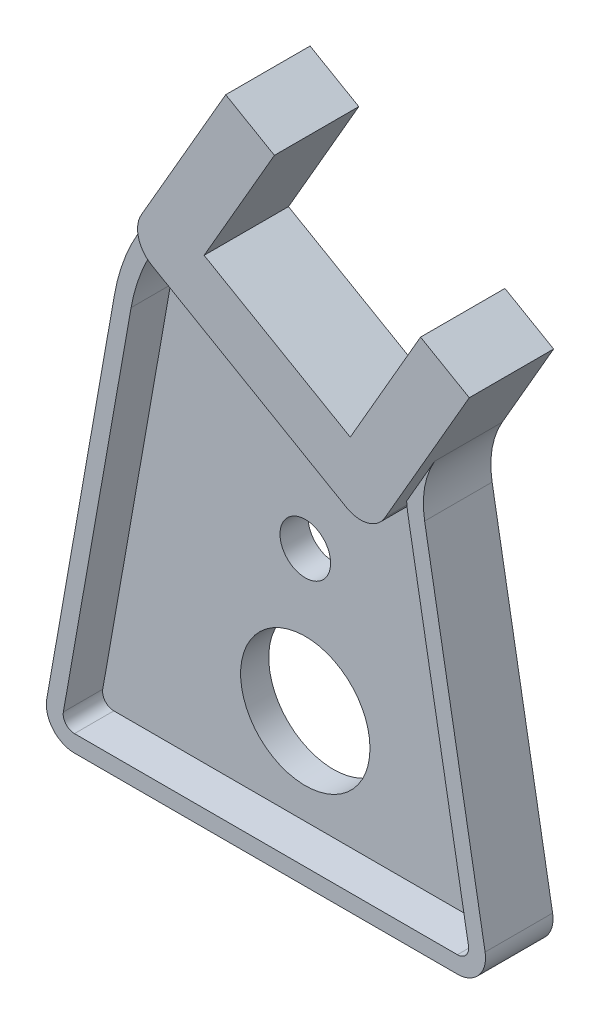
from build123d import *

# Parameters (mm, degrees)
BOSS_EXTRUDE1_DEPTH = 12
SKETCH1_3_R         = 11.5
SKETCH1_3_R_2       = 4.5
BOSS_EXTRUDE2_DEPTH = 5
BOSS_EXTRUDE3_DEPTH = 15


with BuildPart() as part:
    # Sketch1 → Boss-Extrude1 (new body)
    with BuildSketch(Plane.XY):
        with BuildLine():
            ThreePointArc((-38.965270802, 5.868240888), (-37.871454253, 1.786061952), (-34.041232037, 0))
            Line((-34.041232037, 0), (34.041232037, 0))
            ThreePointArc((34.041232037, 0), (37.871454253, 1.786061952), (38.965270802, 5.868240888))
            Line((38.965270802, 5.868240888), (28.21296165, 66.847616303))
            ThreePointArc((28.21296165, 66.847616303), (28.21296165, 72.057061633), (29.994696888, 76.952338968))
            Line((29.994696888, 76.952338968), (25.019759703, 68.335494998))
            ThreePointArc((25.019759703, 68.335494998), (25.11090605, 67.327726281), (25.258538391, 66.32667177))
            Line((25.258538391, 66.32667177), (36.010847543, 5.347296355))
            ThreePointArc((36.010847543, 5.347296355), (35.573320923, 3.714424781), (34.041232037, 3))
            Line((34.041232037, 3), (-34.041232037, 3))
            ThreePointArc((-34.041232037, 3), (-35.573320923, 3.714424781), (-36.010847543, 5.347296355))
            Line((-36.010847543, 5.347296355), (-23.972860012, 73.618116188))
            ThreePointArc((-23.972860012, 73.618116188), (-22.52917578, 79.006019089), (-20.171824836, 84.061374502))
            Line((-20.171824836, 84.061374502), (-18.843846731, 86.361500052))
            ThreePointArc((-18.843846731, 86.361500052), (-19.812658656, 89.05006884), (-19.150635095, 91.830127019))
            Line((-19.150635095, 91.830127019), (-22.769901048, 85.561374502))
            ThreePointArc((-22.769901048, 85.561374502), (-25.348253643, 80.032079519), (-26.927283271, 74.139060721))
            Line((-26.927283271, 74.139060721), (-38.965270802, 5.868240888))
        make_face()
    extrude(amount=BOSS_EXTRUDE1_DEPTH)

    # Sketch1<3> → Boss-Extrude2 (add)
    with BuildSketch(Plane.XY):
        with BuildLine():
            ThreePointArc((25.258538391, 66.32667177), (25.11090605, 67.327726281), (25.019759703, 68.335494998))
            Line((25.019759703, 68.335494998), (24.150635095, 66.830127019))
            ThreePointArc((24.150635095, 66.830127019), (21.114603301, 64.500497887), (17.320508076, 65))
            Line((17.320508076, 65), (-17.320508076, 85))
            ThreePointArc((-17.320508076, 85), (-18.152460566, 85.602112454), (-18.843846731, 86.361500052))
            Line((-18.843846731, 86.361500052), (-20.171824836, 84.061374502))
            ThreePointArc((-20.171824836, 84.061374502), (-22.52917578, 79.006019089), (-23.972860012, 73.618116188))
            Line((-23.972860012, 73.618116188), (-36.010847543, 5.347296355))
            ThreePointArc((-36.010847543, 5.347296355), (-35.573320923, 3.714424781), (-34.041232037, 3))
            Line((-34.041232037, 3), (34.041232037, 3))
            ThreePointArc((34.041232037, 3), (35.573320923, 3.714424781), (36.010847543, 5.347296355))
            Line((36.010847543, 5.347296355), (25.258538391, 66.32667177))
        make_face()
        with Locations((0, 20)):
            Circle(SKETCH1_3_R, mode=Mode.SUBTRACT)
        with Locations((0, 45)):
            Circle(SKETCH1_3_R_2, mode=Mode.SUBTRACT)
    extrude(amount=BOSS_EXTRUDE2_DEPTH)

    # Sketch1<4> → Boss-Extrude3 (add)
    with BuildSketch(Plane.XY):
        with BuildLine():
            Line((25.019759703, 68.335494998), (29.994696888, 76.952338968))
            Line((29.994696888, 76.952338968), (39.150635095, 92.810889132))
            Line((39.150635095, 92.810889132), (30.490381057, 97.810889132))
            Line((30.490381057, 97.810889132), (17.990381057, 76.160254038))
            Line((17.990381057, 76.160254038), (-7.990381057, 91.160254038))
            Line((-7.990381057, 91.160254038), (4.509618943, 112.810889132))
            Line((4.509618943, 112.810889132), (-4.150635095, 117.810889132))
            Line((-4.150635095, 117.810889132), (-19.150635095, 91.830127019))
            ThreePointArc((-19.150635095, 91.830127019), (-19.812658656, 89.05006884), (-18.843846731, 86.361500052))
            ThreePointArc((-18.843846731, 86.361500052), (-18.152460566, 85.602112454), (-17.320508076, 85))
            Line((-17.320508076, 85), (17.320508076, 65))
            ThreePointArc((17.320508076, 65), (21.114603301, 64.500497887), (24.150635095, 66.830127019))
            Line((24.150635095, 66.830127019), (25.019759703, 68.335494998))
        make_face()
    extrude(amount=BOSS_EXTRUDE3_DEPTH)


solid = part.part
